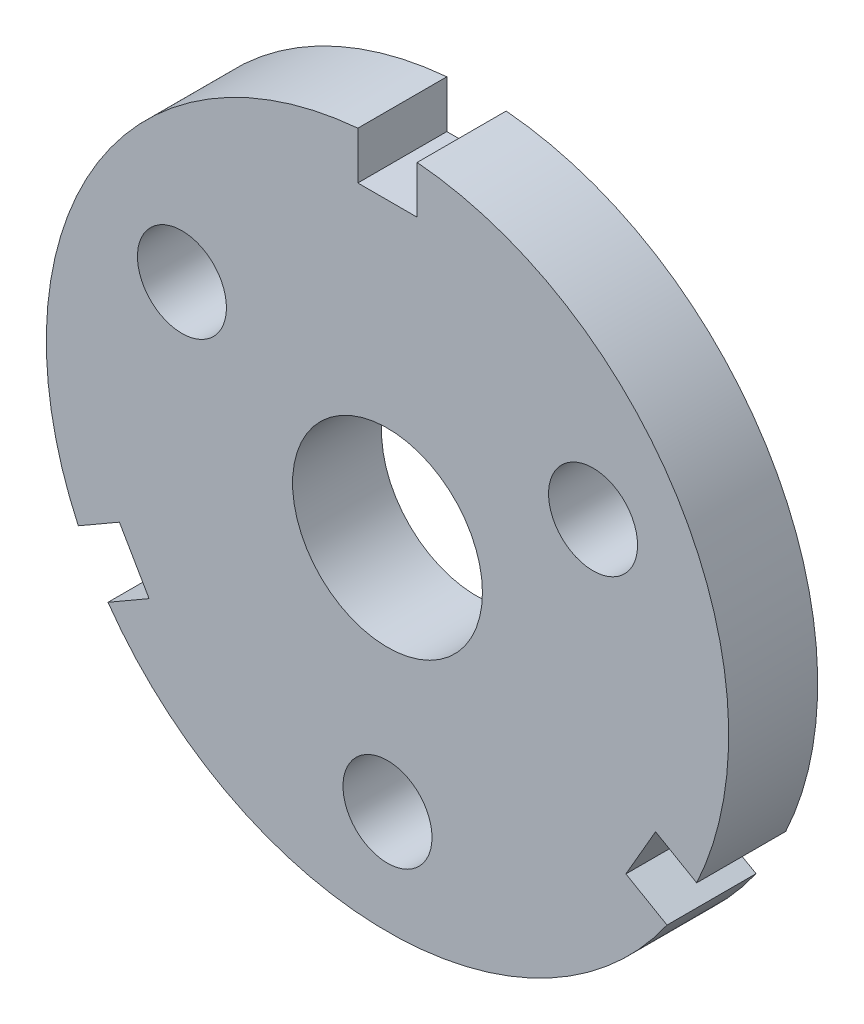
from build123d import *

# Parameters (mm, degrees)
SKETCH1_R           = 7.5
SKETCH1_R_2         = 16
BOSS_EXTRUDE1_DEPTH = 15


with BuildPart() as part:
    # Sketch1 → Boss-Extrude1 (new body)
    with BuildSketch(Plane.XY):
        with BuildLine():
            Line((5, 49.282196187), (-5, 49.282196187))
            Line((-5, 49.282196187), (-5, 57.282196187))
            ThreePointArc((-5, 57.282196187), (-49.796460718, 28.75), (-52.107837082, -24.310971075))
            Line((-52.107837082, -24.310971075), (-45.179633852, -20.310971075))
            Line((-45.179633852, -20.310971075), (-40.179633852, -28.971225112))
            Line((-40.179633852, -28.971225112), (-47.107837082, -32.971225112))
            ThreePointArc((-47.107837082, -32.971225112), (0, -57.5), (47.107837082, -32.971225112))
            Line((47.107837082, -32.971225112), (40.179633852, -28.971225112))
            Line((40.179633852, -28.971225112), (45.179633852, -20.310971075))
            Line((45.179633852, -20.310971075), (52.107837082, -24.310971075))
            ThreePointArc((52.107837082, -24.310971075), (56.135775724, -12.450890887), (57.5, 0))
            ThreePointArc((57.5, 0), (42.389562395, 38.85067567), (5, 57.282196187))
            Line((5, 57.282196187), (5, 49.282196187))
        make_face()
        with Locations((0, -40)):
            Circle(SKETCH1_R, mode=Mode.SUBTRACT)
        with Locations((-34.641016151, 20)):
            Circle(SKETCH1_R, mode=Mode.SUBTRACT)
        Circle(SKETCH1_R_2, mode=Mode.SUBTRACT)
        with Locations((34.641016151, 20)):
            Circle(SKETCH1_R, mode=Mode.SUBTRACT)
    extrude(amount=BOSS_EXTRUDE1_DEPTH)


solid = part.part
